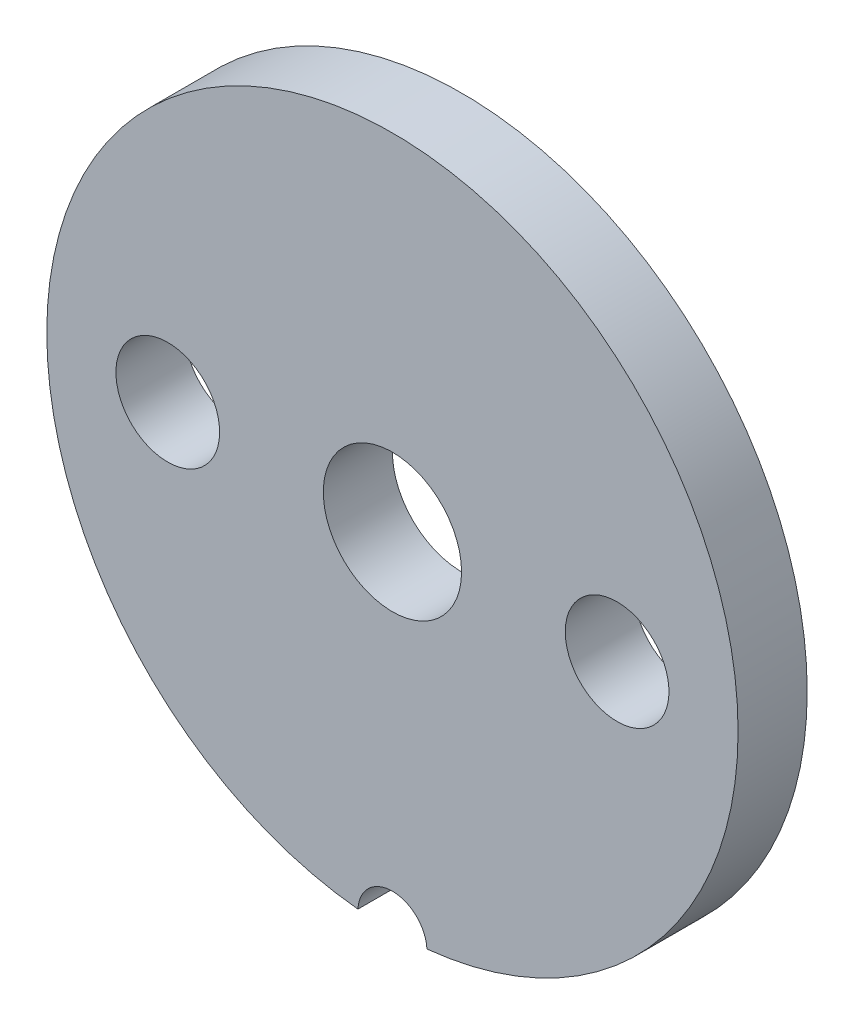
from build123d import *

# Parameters (mm, degrees)
SKETCH_1_R          = 10
SKETCH_1_R_2        = 1.5
SKETCH_1_R_3        = 2
EXTRUDE_1_DEPTH     = 2
SKETCH_2_R          = 1
CUT_EXTRUDE_1_DEPTH = 10


with BuildPart() as part:
    # 草图1 → 凸台-拉伸1 (new body)
    with BuildSketch(Plane.XY):
        with Locations((0.783567134, -3.891783567)):
            Circle(SKETCH_1_R)
        with Locations((-5.716432866, -3.891783567)):
            Circle(SKETCH_1_R_2, mode=Mode.SUBTRACT)
        with Locations(Location((7.283567134, -3.891783567, 0), (0, 0, 180))):
            Circle(SKETCH_1_R_2, mode=Mode.SUBTRACT)
        with Locations((0.783567134, -3.891783567)):
            Circle(SKETCH_1_R_3, mode=Mode.SUBTRACT)
    extrude(amount=EXTRUDE_1_DEPTH)

    # 草图2 → 切除-拉伸1 (cut)
    with BuildSketch(Plane.XY.offset(2)):
        with Locations((0.783567134, -13.891783567)):
            Circle(SKETCH_2_R)
    extrude(amount=-CUT_EXTRUDE_1_DEPTH, mode=Mode.SUBTRACT)


solid = part.part
